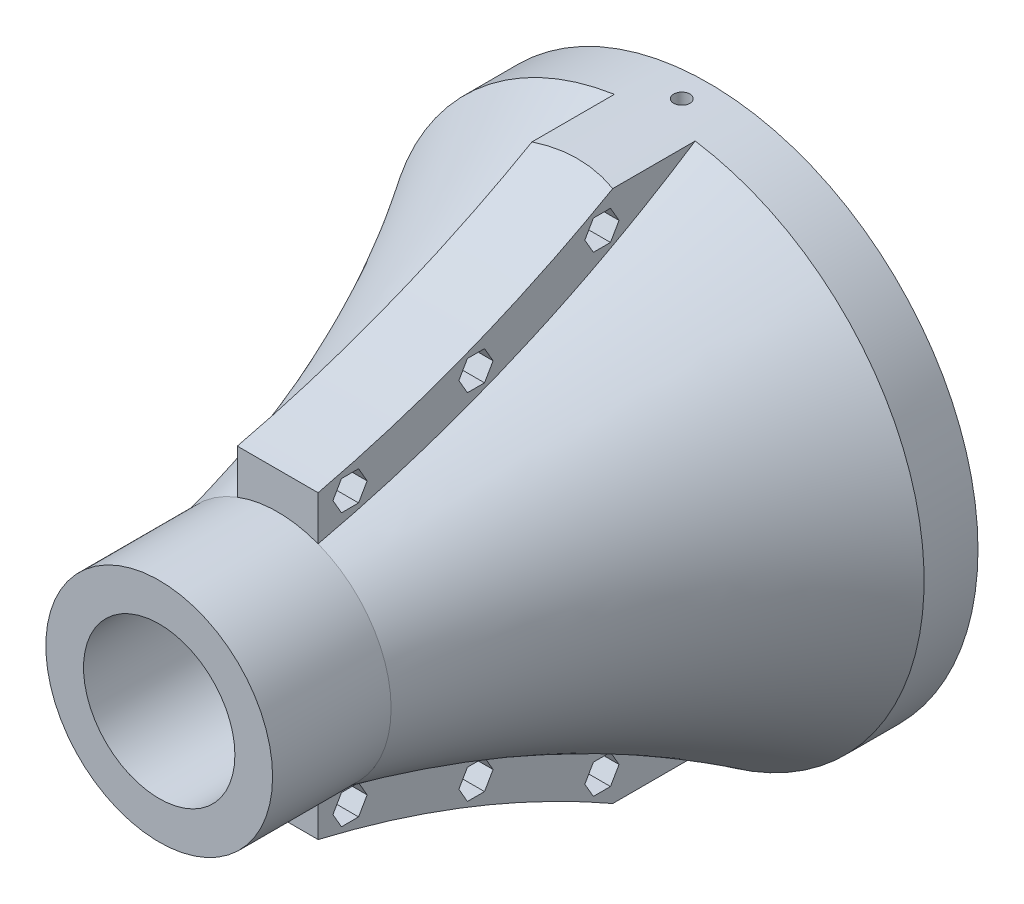
from build123d import *
from build123d.topology import SkipClean

# Parameters (mm, degrees)
SKETCH2_R               = 50
SKETCH2_R_2             = 30
BOSS_EXTRUDE1_DEPTH     = 10
CUT_EXTRUDE1_DEPTH      = 72.414284285
CUT_EXTRUDE1_DEPTH_BACK = 72.414284285
SKETCH3_R               = 1.5
SKETCH5_W               = 42.1
SKETCH5_H               = 42.1
SKETCH5_W_2             = 28.1
SKETCH5_H_2             = 28.1
BOSS_EXTRUDE3_DEPTH     = 32
SKETCH6_W               = 15
SKETCH6_H               = 10
CUT_EXTRUDE2_DEPTH      = 7
SKETCH7_W               = 42.1
SKETCH7_H               = 42.1
SKETCH7_R               = 14.05
BOSS_EXTRUDE4_DEPTH     = 40
CUT_EXTRUDE3_START      = -72
CUT_EXTRUDE3_DEPTH      = 72
CIRPATTERN1_COUNT       = 4
SKETCH12_R              = 21.05
SKETCH12_W              = 20.1
SKETCH12_H              = 20.1
BOSS_EXTRUDE5_DEPTH     = 10
BOSS_EXTRUDE7_REACH     = 153.341
SKETCH14_W              = 15
SKETCH14_H              = 70
CUT_EXTRUDE4_DEPTH      = 128.319480137
CUT_EXTRUDE5_DEPTH      = 5
SKETCH19_R              = 1.65
CUT_EXTRUDE6_DEPTH      = 128.319480137
SKETCH20_R              = 2.875
CUT_EXTRUDE7_DEPTH      = 5
CUT_EXTRUDE8_DEPTH      = 125.112851957
CUT_EXTRUDE8_DEPTH_BACK = 125.112851957
SKETCH21_R              = 62
SKETCH21_R_2            = 50


with BuildPart() as part:
    # Sketch2 → Boss-Extrude1 (new body)
    with BuildSketch(Plane.XY):
        Circle(SKETCH2_R)
        Circle(SKETCH2_R_2, mode=Mode.SUBTRACT)
    extrude(amount=BOSS_EXTRUDE1_DEPTH)

    # Sketch3 → Cut-Extrude1 (cut, two sides: drawn at the far end of the back side and taken through both)
    with BuildSketch(Plane(origin=(0, 0, 0), x_dir=(1, 0, 0), z_dir=(0, 1, 0)).offset(-CUT_EXTRUDE1_DEPTH_BACK)):
        with Locations(Location((0, -5, 0), (0, 0, 270))):
            Circle(SKETCH3_R)
    extrude(amount=CUT_EXTRUDE1_DEPTH + CUT_EXTRUDE1_DEPTH_BACK, mode=Mode.SUBTRACT)



with BuildPart() as body_2:
    # Sketch5 → Boss-Extrude3 (new body)
    with BuildSketch(Plane.XY.offset(30)):
        Rectangle(SKETCH5_W, SKETCH5_H)
        Rectangle(SKETCH5_W_2, SKETCH5_H_2, mode=Mode.SUBTRACT)
    extrude(amount=BOSS_EXTRUDE3_DEPTH)

    # Sketch6 → Cut-Extrude2 (cut)
    with BuildSketch(Plane(origin=(0, 21.05, 0), x_dir=(1, 0, 0), z_dir=(0, 1, 0))):
        with Locations((0, -37.5)):
            Rectangle(SKETCH6_W, SKETCH6_H)
    extrude(amount=-CUT_EXTRUDE2_DEPTH, mode=Mode.SUBTRACT)

    # Sketch7 → Boss-Extrude4 (add)
    with BuildSketch(Plane.XY.offset(62)):
        Rectangle(SKETCH7_W, SKETCH7_H)
        Circle(SKETCH7_R, mode=Mode.SUBTRACT)
    extrude(amount=BOSS_EXTRUDE4_DEPTH)

    # Sketch11 → Cut-Extrude3 (cut)
    with BuildSketch(Plane.XY.offset(102).offset(CUT_EXTRUDE3_START)):
        with BuildLine():
            Line((0, 21.05), (-21.05, 21.05))
            Line((-21.05, 21.05), (-21.05, 0))
            ThreePointArc((-21.05, 0), (-14.884597744, 14.884597744), (0, 21.05))
        make_face()
    cut_extrude3 = extrude(amount=CUT_EXTRUDE3_DEPTH, mode=Mode.SUBTRACT)

    # CirPattern1: Cut-Extrude3 ×4 about axis
    cirpattern1_axis = Axis((0, 0, 102), (0, 0, 1))
    for i in range(1, CIRPATTERN1_COUNT):
        add(cut_extrude3.rotate(cirpattern1_axis, i * 360 / CIRPATTERN1_COUNT), mode=Mode.SUBTRACT)


with BuildPart() as part_1:
    add(part.part)

    add(body_2.part)  # Revolve2 merges body 2
    # Sketch10 → Revolve2 (revolve)
    with BuildSketch(Plane(origin=(0, 0, 0), x_dir=(1, 0, 0), z_dir=(0, 1, 0))):
        with BuildLine():
            Line((-50, -10), (-30, -10))
            add(Edge.make_bspline(
                [(-30, -10), (-20.578064573, -18.073267371), (-21.05, -30)],
                knots=[0, 0, 0, 1, 1, 1], degree=2))
            Line((-21.05, -30), (-21.05, -80))
            add(Edge.make_bspline(
                [(-50, -10), (-29.091325996, -42.246977979), (-21.05, -80)],
                knots=[0, 0, 0, 1, 1, 1], degree=2))
        make_face()
    revolve(axis=Axis((0, 0, 0), (0, 0, 1)))

    # Sketch12 → Boss-Extrude5 (add)
    with BuildSketch(Plane(origin=(0, 0, 30), x_dir=(-1, 0, 0), z_dir=(0, 0, -1))):
        with Locations(Location((0, 0, 0), (0, 0, 180))):
            Circle(SKETCH12_R)
        Rectangle(SKETCH12_W, SKETCH12_H, mode=Mode.SUBTRACT)
    extrude(amount=BOSS_EXTRUDE5_DEPTH)

    # Sketch14 → Boss-Extrude7 (add, up to next)
    with BuildSketch(Plane(origin=(0, -50, 0), x_dir=(-1, 0, 0), z_dir=(0, -1, 0)), mode=Mode.PRIVATE) as boss_extrude7_sk1:
        with Locations((0, -45)):
            Rectangle(SKETCH14_W, SKETCH14_H)
    boss_extrude7_tool1 = extrude(boss_extrude7_sk1.sketch, amount=-BOSS_EXTRUDE7_REACH, mode=Mode.PRIVATE) - part_1.part
    boss_extrude7 = boss_extrude7_tool1.solids().sort_by_distance((0, -50, 45))[0]
    add(boss_extrude7)

    # Mirror1: Boss-Extrude7 across plane
    add(boss_extrude7.mirror(Plane.ZX))

    # Sketch18 → Cut-Extrude4 (cut, through all)
    with BuildSketch(Plane(origin=(7.5, 0, 0), x_dir=(0, 0, -1), z_dir=(1, 0, 0))):
        with BuildLine():
            Line((-80, 27.881894204), (-95.549914696, 45.300101939))
            Line((-95.549914696, 45.300101939), (-64.8581326, 70.718846583))
            Line((-64.8581326, 70.718846583), (-24.317299445, 50))
            add(Edge.make_bspline(
                [(-80, 27.881894204), (-79.852014553, 27.916979073), (-74.658107295, 29.154318718), (-63.788164899, 32.185447068), (-47.760734582, 38.081618303), (-35.142936428, 44.018873417), (-27.446047854, 48.207880107), (-24.987726112, 49.612043743), (-24.317299445, 50)],
                knots=[0.024748206, 0.024748206, 0.024748206, 0.024748206, 0.030935258, 0.241989198, 0.483978396, 0.725967594, 0.809917247, 0.841525156, 0.841525156, 0.841525156, 0.841525156], degree=3))
        make_face()
    cut_extrude4 = extrude(amount=-CUT_EXTRUDE4_DEPTH, mode=Mode.SUBTRACT)

    # Mirror2: Cut-Extrude4 across plane
    add(cut_extrude4.mirror(Plane.ZX), mode=Mode.SUBTRACT)

    # Sketch16 → Cut-Extrude5 (cut)
    with BuildSketch(Plane(origin=(7.5, 0, 0), x_dir=(0, 0, -1), z_dir=(1, 0, 0))):
        Polygon((-75.664959049, -27.9889402), (-72.489532568, -27.9889402), (-70.901819328, -25.2389402), (-72.489532568, -22.4889402), (-75.664959049, -22.4889402), (-77.252672289, -25.2389402), align=None)
        Polygon((-28.901585094, -46.484713922), (-25.726158614, -46.484713922), (-24.138445373, -43.734713922), (-25.726158614, -40.984713922), (-28.901585094, -40.984713922), (-30.489298335, -43.734713922), align=None)
        Polygon((-52.283272074, -35.607454261), (-49.107845593, -35.607454261), (-47.520132353, -32.857454261), (-49.107845593, -30.107454261), (-52.283272074, -30.107454261), (-53.870985314, -32.857454261), align=None)
        Polygon((-30.489298335, 43.734713922), (-28.901585094, 46.484713922), (-25.726158614, 46.484713922), (-24.138445373, 43.734713922), (-25.726158614, 40.984713922), (-28.901585094, 40.984713922), align=None)
        Polygon((-53.870985314, 32.857454261), (-52.283272074, 35.607454261), (-49.107845593, 35.607454261), (-47.520132353, 32.857454261), (-49.107845593, 30.107454261), (-52.283272074, 30.107454261), align=None)
        Polygon((-75.664959049, 22.4889402), (-77.252672289, 25.2389402), (-75.664959049, 27.9889402), (-72.489532568, 27.9889402), (-70.901819328, 25.2389402), (-72.489532568, 22.4889402), align=None)
    extrude(amount=-CUT_EXTRUDE5_DEPTH, mode=Mode.SUBTRACT)

    # Sketch19 → Cut-Extrude6 (cut, through all)
    with BuildSketch(Plane(origin=(7.5, 0, 0), x_dir=(0, 0, -1), z_dir=(1, 0, 0))):
        with Locations((-27.313871854, -43.734713922)):
            Circle(SKETCH19_R)
        with Locations((-50.695558833, -32.857454261)):
            Circle(SKETCH19_R)
        with Locations((-74.077245808, -25.2389402)):
            Circle(SKETCH19_R)
        with Locations((-27.313871854, 43.734713922)):
            Circle(SKETCH19_R)
        with Locations((-50.695558833, 32.857454261)):
            Circle(SKETCH19_R)
        with Locations((-74.077245808, 25.2389402)):
            Circle(SKETCH19_R)
    extrude(amount=-CUT_EXTRUDE6_DEPTH, mode=Mode.SUBTRACT)

    # Sketch20 → Cut-Extrude7 (cut)
    with BuildSketch(Plane.ZY.offset(7.5)):
        with Locations((74.077245808, 25.2389402)):
            Circle(SKETCH20_R)
        with Locations((50.695558833, 32.857454261)):
            Circle(SKETCH20_R)
        with Locations((27.313871854, 43.734713922)):
            Circle(SKETCH20_R)
        with Locations(Location((74.077245808, -25.2389402, 0), (0, 0, 180))):
            Circle(SKETCH20_R)
        with Locations(Location((50.695558833, -32.857454261, 0), (0, 0, 180))):
            Circle(SKETCH20_R)
        with Locations(Location((27.313871854, -43.734713922, 0), (0, 0, 180))):
            Circle(SKETCH20_R)
    extrude(amount=-CUT_EXTRUDE7_DEPTH, mode=Mode.SUBTRACT)

    # Sketch21 → Cut-Extrude8 (cut, two sides: drawn at the far end of the back side and taken through both)
    with SkipClean():  # the faces are left unmerged after this step: merging them gives an invalid solid
        with BuildSketch(Plane(origin=(0, 0, 0), x_dir=(-1, 0, 0), z_dir=(0, 0, -1)).offset(-CUT_EXTRUDE8_DEPTH_BACK)):
            Circle(SKETCH21_R)
            with Locations(Location((0, 0, 0), (0, 0, 278.626926559))):
                Circle(SKETCH21_R_2, mode=Mode.SUBTRACT)
        extrude(amount=CUT_EXTRUDE8_DEPTH + CUT_EXTRUDE8_DEPTH_BACK, mode=Mode.SUBTRACT)


solid = part_1.part
